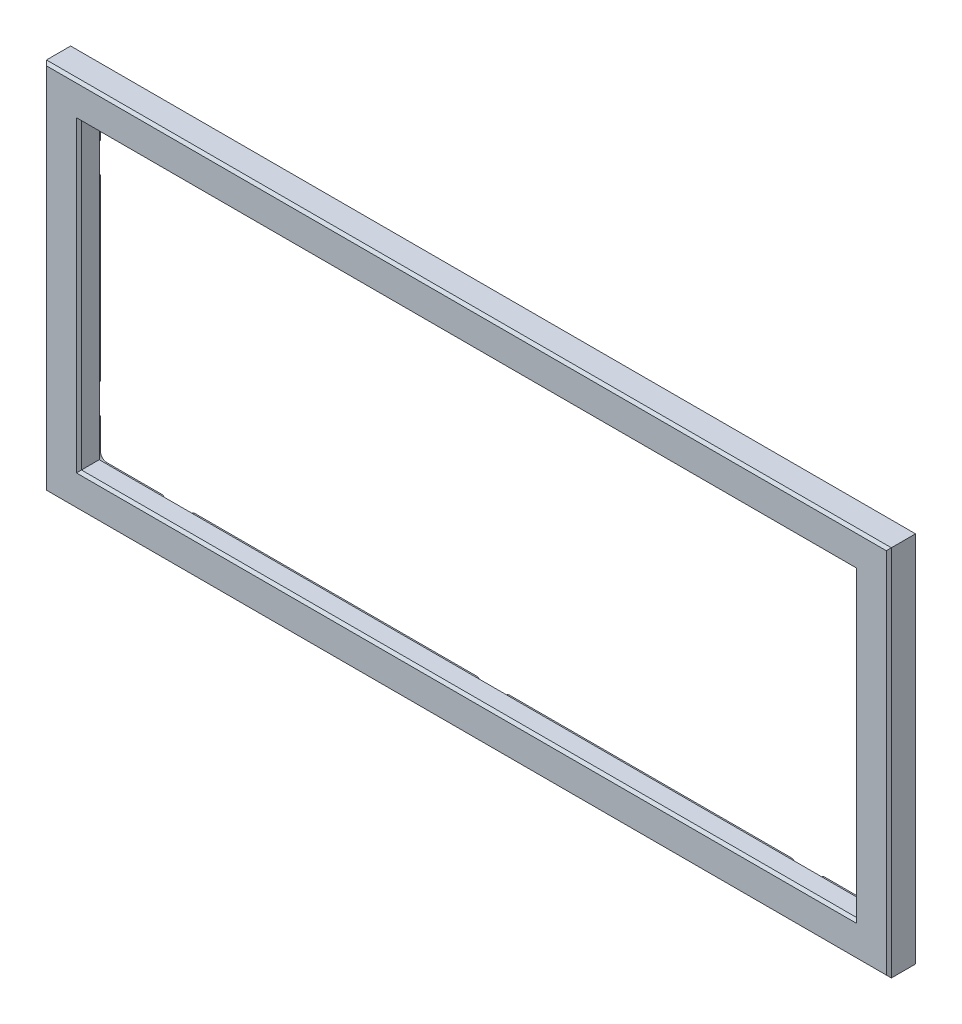
from build123d import *

# Parameters (mm, degrees)
SKETCH1_W               = 332.275
SKETCH1_H               = 146.5375
BOSS_EXTRUDE1_DEPTH     = 1.25
SKETCH2_W               = 332.275
SKETCH2_H               = 146.5375
SKETCH2_W_2             = 304.75
SKETCH2_H_2             = 119.0125
BOSS_EXTRUDE2_DEPTH     = 8
CHAMFER1_SIZE           = 1
M2_5_TAPPED_HOLE1_D     = 2.05
M2_5_TAPPED_HOLE1_DEPTH = 6.35
M2_5_TAPPED_HOLE1_TIP   = 0.615882135


with BuildPart() as part:
    # Sketch1 → Boss-Extrude1 (new, symmetric)
    with BuildSketch(Plane.XY):
        with Locations((161.924998435, 69.056249667)):
            Rectangle(SKETCH1_W, SKETCH1_H)
        with BuildLine():
            Line((313.799998435, 130.562499667), (292.299998435, 130.562499667))
            ThreePointArc((292.299998435, 130.562499667), (291.239338263, 131.001839495), (290.799998435, 132.062499667))
            Line((290.799998435, 132.062499667), (290.799998435, 132.562499667))
            ThreePointArc((290.799998435, 132.562499667), (285.799998435, 137.562499667), (280.799998435, 132.562499667))
            Line((280.799998435, 132.562499667), (280.799998435, 132.062499667))
            ThreePointArc((280.799998435, 132.062499667), (280.360658607, 131.001839495), (279.299998435, 130.562499667))
            Line((279.299998435, 130.562499667), (168.424998435, 130.562499667))
            ThreePointArc((168.424998435, 130.562499667), (167.364338263, 131.001839495), (166.924998435, 132.062499667))
            Line((166.924998435, 132.062499667), (166.924998435, 132.562499667))
            ThreePointArc((166.924998435, 132.562499667), (161.924998435, 137.562499667), (156.924998435, 132.562499667))
            Line((156.924998435, 132.562499667), (156.924998435, 132.062499667))
            ThreePointArc((156.924998435, 132.062499667), (156.485658607, 131.001839495), (155.424998435, 130.562499667))
            Line((155.424998435, 130.562499667), (44.549998435, 130.562499667))
            ThreePointArc((44.549998435, 130.562499667), (43.489338263, 131.001839495), (43.049998435, 132.062499667))
            Line((43.049998435, 132.062499667), (43.049998435, 132.562499667))
            ThreePointArc((43.049998435, 132.562499667), (38.049998435, 137.562499667), (33.049998435, 132.562499667))
            Line((33.049998435, 132.562499667), (33.049998435, 132.062499667))
            ThreePointArc((33.049998435, 132.062499667), (32.610658607, 131.001839495), (31.549998435, 130.562499667))
            Line((31.549998435, 130.562499667), (10.049998435, 130.562499667))
            ThreePointArc((10.049998435, 130.562499667), (8.282231482, 129.83026662), (7.549998435, 128.062499667))
            Line((7.549998435, 128.062499667), (7.549998435, 116.562499667))
            ThreePointArc((7.549998435, 116.562499667), (7.110658607, 115.501839495), (6.049998435, 115.062499667))
            Line((6.049998435, 115.062499667), (5.549998435, 115.062499667))
            ThreePointArc((5.549998435, 115.062499667), (0.549998435, 110.062499667), (5.549998435, 105.062499667))
            Line((5.549998435, 105.062499667), (6.049998435, 105.062499667))
            ThreePointArc((6.049998435, 105.062499667), (7.110658607, 104.623159839), (7.549998435, 103.562499667))
            Line((7.549998435, 103.562499667), (7.549998435, 34.549999667))
            ThreePointArc((7.549998435, 34.549999667), (7.110658607, 33.489339495), (6.049998435, 33.049999667))
            Line((6.049998435, 33.049999667), (5.549998435, 33.049999667))
            ThreePointArc((5.549998435, 33.049999667), (0.549998435, 28.049999667), (5.549998435, 23.049999667))
            Line((5.549998435, 23.049999667), (6.049998435, 23.049999667))
            ThreePointArc((6.049998435, 23.049999667), (7.110658607, 22.610659839), (7.549998435, 21.549999667))
            Line((7.549998435, 21.549999667), (7.549998435, 10.049999667))
            ThreePointArc((7.549998435, 10.049999667), (8.282231482, 8.282232714), (10.049998435, 7.549999667))
            Line((10.049998435, 7.549999667), (31.549998435, 7.549999667))
            ThreePointArc((31.549998435, 7.549999667), (32.610658607, 7.110659839), (33.049998435, 6.049999667))
            Line((33.049998435, 6.049999667), (33.049998435, 5.549999667))
            ThreePointArc((33.049998435, 5.549999667), (38.049998435, 0.549999667), (43.049998435, 5.549999667))
            Line((43.049998435, 5.549999667), (43.049998435, 6.049999667))
            ThreePointArc((43.049998435, 6.049999667), (43.489338263, 7.110659839), (44.549998435, 7.549999667))
            Line((44.549998435, 7.549999667), (155.424998435, 7.549999667))
            ThreePointArc((155.424998435, 7.549999667), (156.485658607, 7.110659839), (156.924998435, 6.049999667))
            Line((156.924998435, 6.049999667), (156.924998435, 5.549999667))
            ThreePointArc((156.924998435, 5.549999667), (161.924998435, 0.549999667), (166.924998435, 5.549999667))
            Line((166.924998435, 5.549999667), (166.924998435, 6.049999667))
            ThreePointArc((166.924998435, 6.049999667), (167.364338263, 7.110659839), (168.424998435, 7.549999667))
            Line((168.424998435, 7.549999667), (279.299998435, 7.549999667))
            ThreePointArc((279.299998435, 7.549999667), (280.360658607, 7.110659839), (280.799998435, 6.049999667))
            Line((280.799998435, 6.049999667), (280.799998435, 5.549999667))
            ThreePointArc((280.799998435, 5.549999667), (285.799998435, 0.549999667), (290.799998435, 5.549999667))
            Line((290.799998435, 5.549999667), (290.799998435, 6.049999667))
            ThreePointArc((290.799998435, 6.049999667), (291.239338263, 7.110659839), (292.299998435, 7.549999667))
            Line((292.299998435, 7.549999667), (313.799998435, 7.549999667))
            ThreePointArc((313.799998435, 7.549999667), (315.567765388, 8.282232714), (316.299998435, 10.049999667))
            Line((316.299998435, 10.049999667), (316.299998435, 21.549999667))
            ThreePointArc((316.299998435, 21.549999667), (316.739338263, 22.610659839), (317.799998435, 23.049999667))
            Line((317.799998435, 23.049999667), (318.299998435, 23.049999667))
            ThreePointArc((318.299998435, 23.049999667), (323.299998435, 28.049999667), (318.299998435, 33.049999667))
            Line((318.299998435, 33.049999667), (317.799998435, 33.049999667))
            ThreePointArc((317.799998435, 33.049999667), (316.739338263, 33.489339495), (316.299998435, 34.549999667))
            Line((316.299998435, 34.549999667), (316.299998435, 103.562499667))
            ThreePointArc((316.299998435, 103.562499667), (316.739338263, 104.623159839), (317.799998435, 105.062499667))
            Line((317.799998435, 105.062499667), (318.299998435, 105.062499667))
            ThreePointArc((318.299998435, 105.062499667), (323.299998435, 110.062499667), (318.299998435, 115.062499667))
            Line((318.299998435, 115.062499667), (317.799998435, 115.062499667))
            ThreePointArc((317.799998435, 115.062499667), (316.739338263, 115.501839495), (316.299998435, 116.562499667))
            Line((316.299998435, 116.562499667), (316.299998435, 128.062499667))
            ThreePointArc((316.299998435, 128.062499667), (315.567765388, 129.83026662), (313.799998435, 130.562499667))
        make_face(mode=Mode.SUBTRACT)
    extrude(amount=BOSS_EXTRUDE1_DEPTH, both=True)

    # Sketch2 → Boss-Extrude2 (add)
    with BuildSketch(Plane.XY.offset(1.25)):
        with Locations((161.924998435, 69.056249667)):
            Rectangle(SKETCH2_W, SKETCH2_H)
        with Locations((161.924998435, 69.056249667)):
            Rectangle(SKETCH2_W_2, SKETCH2_H_2, mode=Mode.SUBTRACT)
    extrude(amount=BOSS_EXTRUDE2_DEPTH)

    # Chamfer1
    chamfer1_edges = [part.edges().sort_by_distance(p)[0] for p in [
        (161.924998435, 9.549999667, 9.25),
        (9.549998435, 69.056249667, 9.25),
        (161.924998435, -4.212500333, 9.25),
        (328.062498435, 69.056249667, 9.25),
        (161.924998435, 142.324999667, 9.25),
        (-4.212501565, 69.056249667, 9.25),
        (161.924998435, 128.562499667, 9.25),
        (314.299998435, 69.056249667, 9.25),
    ]]
    chamfer(chamfer1_edges, length=CHAMFER1_SIZE)

    # M2.5 Tapped Hole1
    with Locations(Plane(origin=(0, 0, 1.25), x_dir=(-1, 0, 0), z_dir=(0, 0, -1))):
        with Locations((-285.799998435, 132.562499667), (-318.299998435, 110.062499667), (-318.299998435, 28.049999667), (-285.799998435, 5.549999667), (-161.924998435, 5.549999667), (-38.049998435, 5.549999667), (-5.549998435, 28.049999667), (-38.049998435, 132.562499667), (-5.549998435, 110.062499667), (-161.924998435, 132.562499667)):
            Hole(M2_5_TAPPED_HOLE1_D / 2, depth=M2_5_TAPPED_HOLE1_DEPTH)
            with Locations((0, 0, -(M2_5_TAPPED_HOLE1_DEPTH + M2_5_TAPPED_HOLE1_TIP / 2))):  # 118° drill point
                Cone(0, M2_5_TAPPED_HOLE1_D / 2, M2_5_TAPPED_HOLE1_TIP, mode=Mode.SUBTRACT)


solid = part.part
